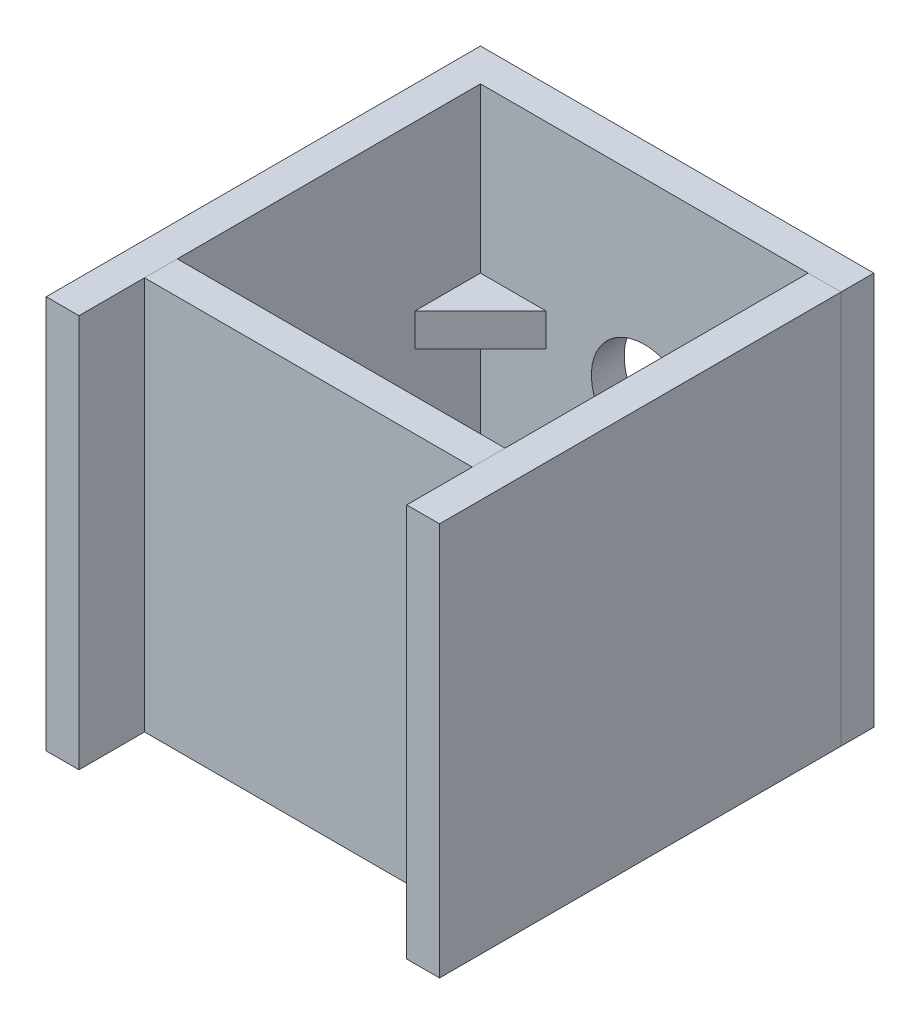
from build123d import *

# Parameters (mm, degrees)
SKETCH1_W                       = 76.2
SKETCH1_H                       = 76.2
BOSS_EXTRUDE1_DEPTH             = 6.35
SKETCH2_W                       = 6.35
SKETCH2_H                       = 76.2
BOSS_EXTRUDE2_DEPTH             = 77.7875
BOSS_EXTRUDE2_2_DEPTH           = 77.7875
SKETCH3_R                       = 10.2616
CUT_EXTRUDE1_DEPTH              = 95.626186419
BOSS_EXTRUDE3_REACH             = 101.912
SKETCH4_W                       = 63.5
SKETCH4_H                       = 6.35
BOSS_EXTRUDE3_DIRECTION_2_REACH = 101.912
BOSS_EXTRUDE4_DEPTH             = 6.35


with BuildPart() as part:
    # Sketch1 → Boss-Extrude1 (new body)
    with BuildSketch(Plane.XY):
        Rectangle(SKETCH1_W, SKETCH1_H)
    extrude(amount=BOSS_EXTRUDE1_DEPTH)

    # Sketch3 → Cut-Extrude1 (cut, through all)
    with BuildSketch(Plane.XY.offset(6.35)):
        Circle(SKETCH3_R)
    extrude(amount=-CUT_EXTRUDE1_DEPTH, mode=Mode.SUBTRACT)



with BuildPart() as body_2:
    # Sketch2 → Boss-Extrude2 (new body)
    with BuildSketch(Plane.XY.offset(6.35)):
        with Locations((-34.925, 0)):
            Rectangle(SKETCH2_W, SKETCH2_H)
    extrude(amount=BOSS_EXTRUDE2_DEPTH)


with BuildPart() as body_3:
    # Sketch2 → Boss-Extrude2 2 (new body)
    with BuildSketch(Plane.XY.offset(6.35)):
        with Locations((34.925, 0)):
            Rectangle(SKETCH2_W, SKETCH2_H)
    extrude(amount=BOSS_EXTRUDE2_2_DEPTH)


with BuildPart() as body_4:

    # Boss-Extrude3: up to this face of the body (flat: up to its plane)
    boss_extrude3_end = Plane(body_2.part.faces().sort_by_distance((-34.925, 38.1, 45.24375))[0])
    # Sketch4 → Boss-Extrude3 (new, up to the picked face)
    with BuildSketch(Plane(origin=(0, 0, 0), x_dir=(1, 0, 0), z_dir=(0, 1, 0)), mode=Mode.PRIVATE) as boss_extrude3_sk1:
        with Locations((0, -68.2625)):
            Rectangle(SKETCH4_W, SKETCH4_H)
    boss_extrude3_tool1 = split(extrude(boss_extrude3_sk1.sketch, amount=BOSS_EXTRUDE3_REACH, mode=Mode.PRIVATE), bisect_by=boss_extrude3_end, keep=Keep.BOTH, mode=Mode.PRIVATE)
    add(boss_extrude3_tool1.solids().sort_by(Axis((0, 0, 68.2625), (0, 1, 0)))[0])


    # Boss-Extrude3 direction 2: up to this face of the body (flat: up to its plane)
    boss_extrude3_direction_2_end = Plane(body_2.part.faces().sort_by_distance((-34.925, -38.1, 45.24375))[0])
    # Sketch4 → Boss-Extrude3 direction 2 (add, up to the picked face)
    with BuildSketch(Plane(origin=(0, 0, 0), x_dir=(1, 0, 0), z_dir=(0, 1, 0)), mode=Mode.PRIVATE) as boss_extrude3_direction_2_sk1:
        with Locations((0, -68.2625)):
            Rectangle(SKETCH4_W, SKETCH4_H)
    boss_extrude3_direction_2_tool1 = split(extrude(boss_extrude3_direction_2_sk1.sketch, amount=-BOSS_EXTRUDE3_DIRECTION_2_REACH, mode=Mode.PRIVATE), bisect_by=boss_extrude3_direction_2_end, keep=Keep.BOTH, mode=Mode.PRIVATE)
    add(boss_extrude3_direction_2_tool1.solids().sort_by(Axis((0, 0, 68.2625), (0, -1, 0)))[0])


with BuildPart() as part_1:
    add(part.part)

    add(body_2.part)  # Boss-Extrude4 merges body 2
    # Sketch5 → Boss-Extrude4 (add)
    with BuildSketch(Plane(origin=(0, 0, 0), x_dir=(1, 0, 0), z_dir=(0, 1, 0))):
        Polygon((-19.05, -6.35), (-31.75, -19.05), (-31.75, -6.35), align=None)
    extrude(amount=BOSS_EXTRUDE4_DEPTH)


solid = Compound([body_3.part, body_4.part, part_1.part])
